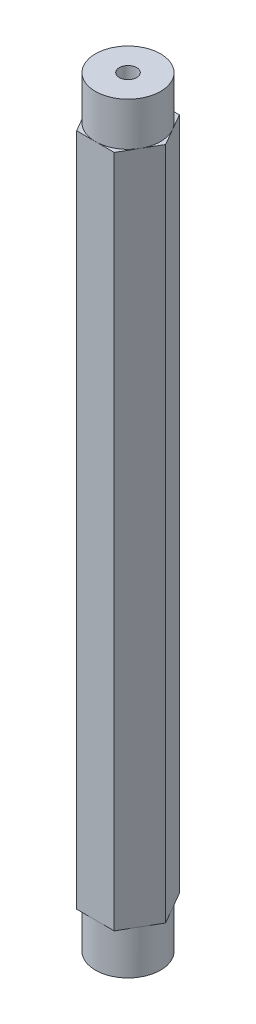
from build123d import *

# Parameters (mm, degrees)
SKETCH1_R           = 0.635
BOSS_EXTRUDE1_DEPTH = 24.638
SKETCH2_R           = 2.38125
SKETCH2_R_2         = 0.635
BOSS_EXTRUDE2_DEPTH = 3.175
BOSS_EXTRUDE3_START = 3.175
SKETCH3_R           = 2.38125
SKETCH3_R_2         = 0.635
BOSS_EXTRUDE3_DEPTH = 3.175


with BuildPart() as part:
    # Sketch1 → Boss-Extrude1 (new, symmetric)
    with BuildSketch(Plane(origin=(0, 0, 0), x_dir=(1, 0, 0), z_dir=(0, 1, 0))):
        Polygon((1.374815329, -2.38125), (2.749630657, 0), (1.374815329, 2.38125), (-1.374815329, 2.38125), (-2.749630657, 0), (-1.374815329, -2.38125), align=None)
        with Locations(Location((0, 0, 0), (0, 0, 270))):
            Circle(SKETCH1_R, mode=Mode.SUBTRACT)
    extrude(amount=BOSS_EXTRUDE1_DEPTH, both=True)

    # Sketch2 → Boss-Extrude2 (add)
    with BuildSketch(Plane(origin=(0, 24.638, 0), x_dir=(1, 0, 0), z_dir=(0, 1, 0))):
        with Locations(Location((0, 0, 0), (0, 0, 270))):
            Circle(SKETCH2_R)
        with Locations(Location((0, 0, 0), (0, 0, 270))):
            Circle(SKETCH2_R_2, mode=Mode.SUBTRACT)
    extrude(amount=BOSS_EXTRUDE2_DEPTH)

    # Sketch3 → Boss-Extrude3 (add)
    with BuildSketch(Plane.XZ.offset(24.638).offset(BOSS_EXTRUDE3_START)):
        with Locations(Location((0, 0, 0), (0, 0, 90))):
            Circle(SKETCH3_R)
        with Locations(Location((0, 0, 0), (0, 0, 270))):
            Circle(SKETCH3_R_2, mode=Mode.SUBTRACT)
    extrude(amount=-BOSS_EXTRUDE3_DEPTH)


solid = part.part
